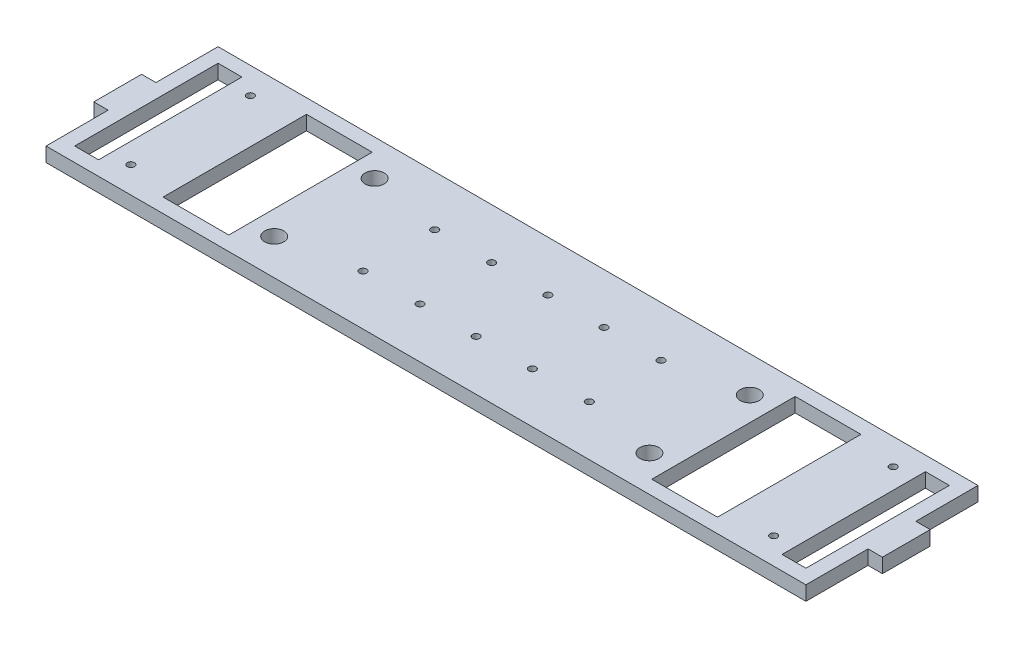
from build123d import *

# Parameters (mm, degrees)
BOSS_EXTRU_1_DEPTH      = 6
ESQUISSE2_R             = 1.5
ENL_V_MAT_EXTRU_1_DEPTH = 169.988165266
ESQUISSE3_R             = 3
ENL_V_MAT_EXTRU_2_DEPTH = 3
ESQUISSE4_R             = 4
ENL_V_MAT_EXTRU_3_DEPTH = 169.988165266
ESQUISSE5_W             = 27.5
ESQUISSE5_H             = 60
ENL_V_MAT_EXTRU_4_DEPTH = 169.988165266
ESQUISSE6_R             = 1.5
ENL_V_MAT_EXTRU_5_DEPTH = 169.988165266
ESQUISSE7_W             = 10
ESQUISSE7_H             = 60
ENL_V_MAT_EXTRU_6_DEPTH = 169.988165266
ESQUISSE8_R             = 3
ENL_V_MAT_EXTRU_7_DEPTH = 3


with BuildPart() as part:
    # Esquisse1 → Boss.-Extru.1 (new body)
    with BuildSketch(Plane(origin=(0, 0, 0), x_dir=(1, 0, 0), z_dir=(0, 1, 0))):
        Polygon((-159, -36), (-159, -10), (-165, -10), (-165, 10), (-159, 10), (-159, 36), (159, 36), (159, 10), (165, 10), (165, -10), (159, -10), (159, -36), align=None)
    extrude(amount=BOSS_EXTRU_1_DEPTH)

    # Esquisse2 → Enlèv. mat.-Extru.1 (cut, through all)
    with BuildSketch(Plane.XZ):
        with Locations(Location((-47.35, 15, 0), (0, 0, 270))):
            Circle(ESQUISSE2_R)
        with Locations(Location((-23.5, 15, 0), (0, 0, 270))):
            Circle(ESQUISSE2_R)
        with Locations(Location((23.5, 15, 0), (0, 0, 90))):
            Circle(ESQUISSE2_R)
        with Locations(Location((47.35, 15, 0), (0, 0, 90))):
            Circle(ESQUISSE2_R)
        with Locations(Location((47.35, -15, 0), (0, 0, 270))):
            Circle(ESQUISSE2_R)
        with Locations(Location((23.5, -15, 0), (0, 0, 270))):
            Circle(ESQUISSE2_R)
        with Locations(Location((-23.5, -15, 0), (0, 0, 90))):
            Circle(ESQUISSE2_R)
        with Locations(Location((-47.35, -15, 0), (0, 0, 90))):
            Circle(ESQUISSE2_R)
        with Locations(Location((0, 15, 0), (0, 0, 270))):
            Circle(ESQUISSE2_R)
        with Locations(Location((0, -15, 0), (0, 0, 90))):
            Circle(ESQUISSE2_R)
    extrude(amount=-ENL_V_MAT_EXTRU_1_DEPTH, mode=Mode.SUBTRACT)

    # Esquisse3 → Enlèv. mat.-Extru.2 (cut)
    with BuildSketch(Plane(origin=(0, 0, 0), x_dir=(-1, 0, 0), z_dir=(0, -1, 0))):
        with Locations(Location((47.35, -15, 0), (0, 0, 90))):
            Circle(ESQUISSE3_R)
        with Locations(Location((23.5, -15, 0), (0, 0, 90))):
            Circle(ESQUISSE3_R)
        with Locations(Location((0, -15, 0), (0, 0, 90))):
            Circle(ESQUISSE3_R)
        with Locations(Location((0, 15, 0), (0, 0, 270))):
            Circle(ESQUISSE3_R)
        with Locations(Location((23.5, 15, 0), (0, 0, 270))):
            Circle(ESQUISSE3_R)
        with Locations(Location((47.35, 15, 0), (0, 0, 270))):
            Circle(ESQUISSE3_R)
        with Locations(Location((-47.35, 15, 0), (0, 0, 90))):
            Circle(ESQUISSE3_R)
        with Locations(Location((-23.5, 15, 0), (0, 0, 90))):
            Circle(ESQUISSE3_R)
        with Locations(Location((-23.5, -15, 0), (0, 0, 270))):
            Circle(ESQUISSE3_R)
        with Locations(Location((-47.35, -15, 0), (0, 0, 270))):
            Circle(ESQUISSE3_R)
    extrude(amount=-ENL_V_MAT_EXTRU_2_DEPTH, mode=Mode.SUBTRACT)

    # Esquisse4 → Enlèv. mat.-Extru.3 (cut, through all)
    with BuildSketch(Plane(origin=(0, 0, 0), x_dir=(-1, 0, 0), z_dir=(0, -1, 0))):
        with Locations(Location((78.5, -21, 0), (0, 0, 90))):
            Circle(ESQUISSE4_R)
        with Locations(Location((-78.5, -21, 0), (0, 0, 270))):
            Circle(ESQUISSE4_R)
        with Locations(Location((78.5, 21, 0), (0, 0, 270))):
            Circle(ESQUISSE4_R)
        with Locations(Location((-78.5, 21, 0), (0, 0, 90))):
            Circle(ESQUISSE4_R)
    extrude(amount=-ENL_V_MAT_EXTRU_3_DEPTH, mode=Mode.SUBTRACT)

    # Esquisse5 → Enlèv. mat.-Extru.4 (cut, through all)
    with BuildSketch(Plane(origin=(0, 0, 0), x_dir=(-1, 0, 0), z_dir=(0, -1, 0))):
        with Locations((102.25, 0)):
            Rectangle(ESQUISSE5_W, ESQUISSE5_H)
        with Locations((-102.25, 0)):
            Rectangle(ESQUISSE5_W, ESQUISSE5_H)
    extrude(amount=-ENL_V_MAT_EXTRU_4_DEPTH, mode=Mode.SUBTRACT)

    # Esquisse6 → Enlèv. mat.-Extru.5 (cut, through all)
    with BuildSketch(Plane(origin=(0, 0, 0), x_dir=(-1, 0, 0), z_dir=(0, -1, 0))):
        with Locations(Location((134.5, -25, 0), (0, 0, 90))):
            Circle(ESQUISSE6_R)
        with Locations(Location((-134.5, -25, 0), (0, 0, 270))):
            Circle(ESQUISSE6_R)
        with Locations(Location((-134.5, 25, 0), (0, 0, 90))):
            Circle(ESQUISSE6_R)
        with Locations(Location((134.5, 25, 0), (0, 0, 270))):
            Circle(ESQUISSE6_R)
    extrude(amount=-ENL_V_MAT_EXTRU_5_DEPTH, mode=Mode.SUBTRACT)

    # Esquisse7 → Enlèv. mat.-Extru.6 (cut, through all)
    with BuildSketch(Plane(origin=(0, 0, 0), x_dir=(-1, 0, 0), z_dir=(0, -1, 0))):
        with Locations((148, 0)):
            Rectangle(ESQUISSE7_W, ESQUISSE7_H)
        with Locations((-148, 0)):
            Rectangle(ESQUISSE7_W, ESQUISSE7_H)
    extrude(amount=-ENL_V_MAT_EXTRU_6_DEPTH, mode=Mode.SUBTRACT)

    # Esquisse8 → Enlèv. mat.-Extru.7 (cut)
    with BuildSketch(Plane.XZ):
        with Locations(Location((-134.5, 25, 0), (0, 0, 270))):
            Circle(ESQUISSE8_R)
        with Locations(Location((-134.5, -25, 0), (0, 0, 270))):
            Circle(ESQUISSE8_R)
        with Locations(Location((134.5, -25, 0), (0, 0, 90))):
            Circle(ESQUISSE8_R)
        with Locations(Location((134.5, 25, 0), (0, 0, 90))):
            Circle(ESQUISSE8_R)
    extrude(amount=-ENL_V_MAT_EXTRU_7_DEPTH, mode=Mode.SUBTRACT)


solid = part.part
